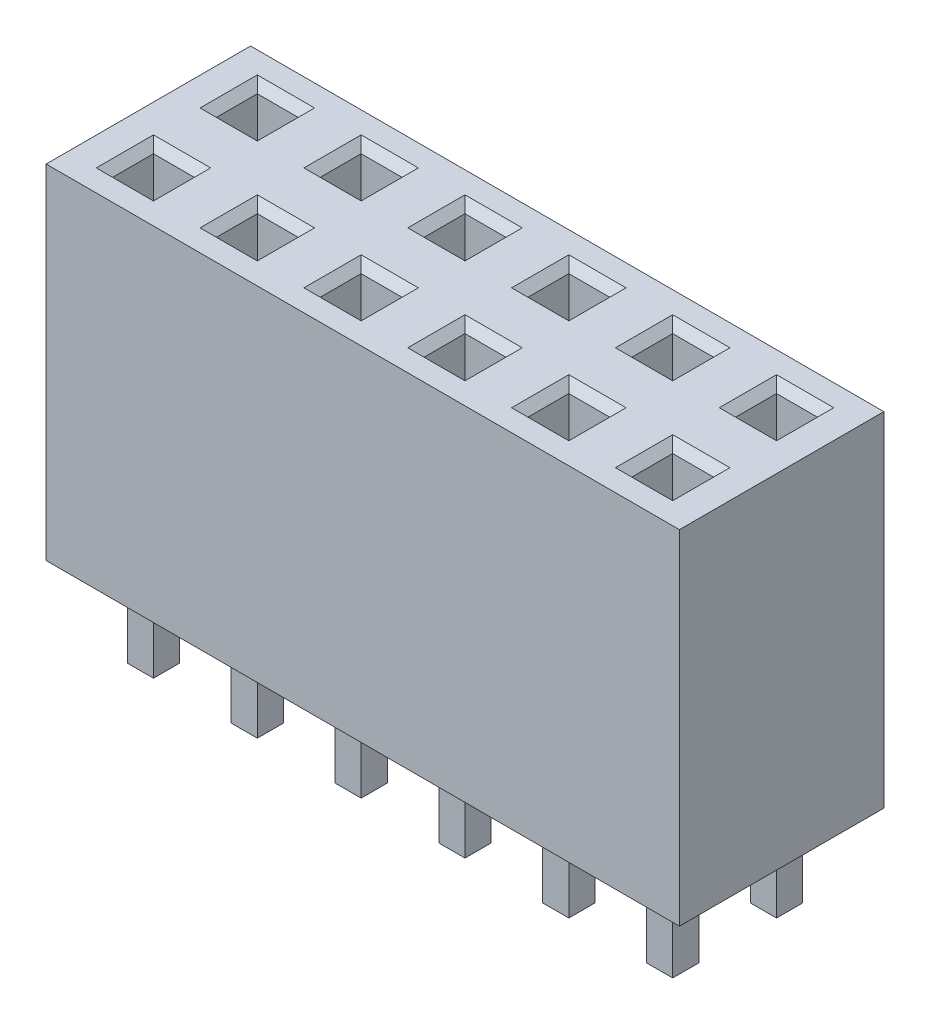
from build123d import *

# Parameters (mm, degrees)
SKETCH_1_W                         = 2.79
SKETCH_1_H                         = 5
EXTRUDE_1_DEPTH                    = 8.4
SKETCH_2_W                         = 1
SKETCH_2_H                         = 1
CUT_EXTRUDE_1_DEPTH                = 8
CHAMFER_1_SIZE                     = 0.2
SKETCH_3_W                         = 0.64
SKETCH_3_H                         = 0.64
EXTRUDE_2_DEPTH                    = 2.29
CHAMFER_2_SIZE                     = 0.2
PATTERN_LINEAR_1_COUNT             = 6
PATTERN_LINEAR_1_PITCH             = 2.54
CHAMFER_1_OF_PATTERN_LINEAR_1_SIZE = 0.2
CHAMFER_2_OF_PATTERN_LINEAR_1_SIZE = 0.2


with BuildPart() as part:
    # Эскиз1 → Бобышка-Вытянуть1 (new body)
    with BuildSketch(Plane(origin=(0, 0, 0), x_dir=(1, 0, 0), z_dir=(0, 1, 0))):
        Rectangle(SKETCH_1_W, SKETCH_1_H)
    extrude_1 = extrude(amount=EXTRUDE_1_DEPTH)

    # Эскиз2 → Вырез-Вытянуть1 (cut)
    with BuildSketch(Plane(origin=(0, 8.4, 0), x_dir=(1, 0, 0), z_dir=(0, 1, 0))):
        with Locations((0, 1.27)):
            Rectangle(SKETCH_2_W, SKETCH_2_H)
        with Locations((0, -1.27)):
            Rectangle(SKETCH_2_W, SKETCH_2_H)
    cut_extrude_1 = extrude(amount=-CUT_EXTRUDE_1_DEPTH, mode=Mode.SUBTRACT)

    # Фаска1
    chamfer_1_edges = [part.edges().sort_by_distance(p)[0] for p in [
        (0.5, 8.4, -1.27),
        (0, 8.4, -1.77),
        (-0.5, 8.4, -1.27),
        (0, 8.4, -0.77),
        (0, 8.4, 1.77),
        (0.5, 8.4, 1.27),
        (0, 8.4, 0.77),
        (-0.5, 8.4, 1.27),
    ]]
    chamfer(chamfer_1_edges, length=CHAMFER_1_SIZE)

    # Эскиз3 → Бобышка-Вытянуть2 (add)
    with BuildSketch(Plane(origin=(0, 0, 0), x_dir=(-1, 0, 0), z_dir=(0, -1, 0))):
        with Locations((0, 1.27)):
            Rectangle(SKETCH_3_W, SKETCH_3_H)
        with Locations((0, -1.27)):
            Rectangle(SKETCH_3_W, SKETCH_3_H)
    extrude_2 = extrude(amount=EXTRUDE_2_DEPTH)

    # Фаска2
    chamfer_2_edges = [part.edges().sort_by_distance(p)[0] for p in [
        (0.32, -2.29, -1.27),
        (0, -2.29, -0.95),
        (-0.32, -2.29, -1.27),
        (0, -2.29, -1.59),
        (-0.32, -2.29, 1.27),
        (0, -2.29, 0.95),
        (0.32, -2.29, 1.27),
        (0, -2.29, 1.59),
    ]]
    chamfer(chamfer_2_edges, length=CHAMFER_2_SIZE)

    # Линейный массив1: Бобышка-Вытянуть1, Вырез-Вытянуть1, Бобышка-Вытянуть2 ×6
    with Locations(*[(i * PATTERN_LINEAR_1_PITCH, 0, 0) for i in range(1, PATTERN_LINEAR_1_COUNT)]):
        add(extrude_1)
        add(cut_extrude_1, mode=Mode.SUBTRACT)
        add(extrude_2)

    # Фаска1 of Линейный массив1
    chamfer_1_of_pattern_linear_1_edges = [part.edges().sort_by_distance(p)[0] for p in [
        (3.04, 8.4, -1.27),
        (2.54, 8.4, -1.77),
        (2.04, 8.4, -1.27),
        (2.54, 8.4, -0.77),
        (2.54, 8.4, 1.77),
        (3.04, 8.4, 1.27),
        (2.54, 8.4, 0.77),
        (2.04, 8.4, 1.27),
        (5.58, 8.4, -1.27),
        (5.08, 8.4, -1.77),
        (4.58, 8.4, -1.27),
        (5.08, 8.4, -0.77),
        (5.08, 8.4, 1.77),
        (5.58, 8.4, 1.27),
        (5.08, 8.4, 0.77),
        (4.58, 8.4, 1.27),
        (8.12, 8.4, -1.27),
        (7.62, 8.4, -1.77),
        (7.12, 8.4, -1.27),
        (7.62, 8.4, -0.77),
        (7.62, 8.4, 1.77),
        (8.12, 8.4, 1.27),
        (7.62, 8.4, 0.77),
        (7.12, 8.4, 1.27),
        (10.66, 8.4, -1.27),
        (10.16, 8.4, -1.77),
        (9.66, 8.4, -1.27),
        (10.16, 8.4, -0.77),
        (10.16, 8.4, 1.77),
        (10.66, 8.4, 1.27),
        (10.16, 8.4, 0.77),
        (9.66, 8.4, 1.27),
        (13.2, 8.4, -1.27),
        (12.7, 8.4, -1.77),
        (12.2, 8.4, -1.27),
        (12.7, 8.4, -0.77),
        (12.7, 8.4, 1.77),
        (13.2, 8.4, 1.27),
        (12.7, 8.4, 0.77),
        (12.2, 8.4, 1.27),
    ]]
    chamfer(chamfer_1_of_pattern_linear_1_edges, length=CHAMFER_1_OF_PATTERN_LINEAR_1_SIZE)

    # Фаска2 of Линейный массив1
    chamfer_2_of_pattern_linear_1_edges = [part.edges().sort_by_distance(p)[0] for p in [
        (2.86, -2.29, -1.27),
        (2.54, -2.29, -0.95),
        (2.22, -2.29, -1.27),
        (2.54, -2.29, -1.59),
        (2.22, -2.29, 1.27),
        (2.54, -2.29, 0.95),
        (2.86, -2.29, 1.27),
        (2.54, -2.29, 1.59),
        (5.4, -2.29, -1.27),
        (5.08, -2.29, -0.95),
        (4.76, -2.29, -1.27),
        (5.08, -2.29, -1.59),
        (4.76, -2.29, 1.27),
        (5.08, -2.29, 0.95),
        (5.4, -2.29, 1.27),
        (5.08, -2.29, 1.59),
        (7.94, -2.29, -1.27),
        (7.62, -2.29, -0.95),
        (7.3, -2.29, -1.27),
        (7.62, -2.29, -1.59),
        (7.3, -2.29, 1.27),
        (7.62, -2.29, 0.95),
        (7.94, -2.29, 1.27),
        (7.62, -2.29, 1.59),
        (10.48, -2.29, -1.27),
        (10.16, -2.29, -0.95),
        (9.84, -2.29, -1.27),
        (10.16, -2.29, -1.59),
        (9.84, -2.29, 1.27),
        (10.16, -2.29, 0.95),
        (10.48, -2.29, 1.27),
        (10.16, -2.29, 1.59),
        (13.02, -2.29, -1.27),
        (12.7, -2.29, -0.95),
        (12.38, -2.29, -1.27),
        (12.7, -2.29, -1.59),
        (12.38, -2.29, 1.27),
        (12.7, -2.29, 0.95),
        (13.02, -2.29, 1.27),
        (12.7, -2.29, 1.59),
    ]]
    chamfer(chamfer_2_of_pattern_linear_1_edges, length=CHAMFER_2_OF_PATTERN_LINEAR_1_SIZE)


solid = part.part
